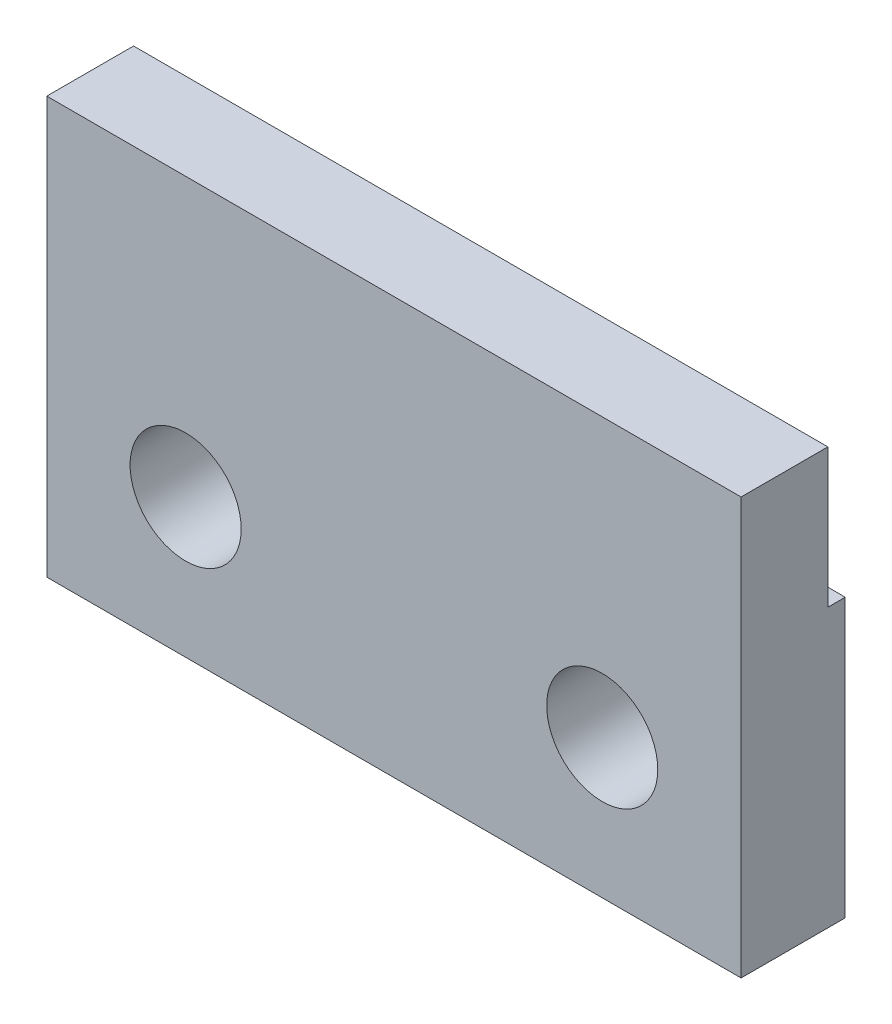
from build123d import *

# Parameters (mm, degrees)
SKETCH1_W            = 20
SKETCH1_H            = 12
BOSS_EXTRUDE1_DEPTH  = 3
SKETCH2_W            = 20
SKETCH2_H            = 4
CUT_EXTRUDE1_DEPTH   = 0.5
M3_CLEARANCE_HOLE1_D = 3.2


with BuildPart() as part:
    # Sketch1 → Boss-Extrude1 (new body)
    with BuildSketch(Plane.XY):
        Rectangle(SKETCH1_W, SKETCH1_H)
    extrude(amount=BOSS_EXTRUDE1_DEPTH)

    # Sketch2 → Cut-Extrude1 (cut)
    with BuildSketch(Plane(origin=(0, 0, 0), x_dir=(-1, 0, 0), z_dir=(0, 0, -1))):
        with Locations((0, 4)):
            Rectangle(SKETCH2_W, SKETCH2_H)
    extrude(amount=-CUT_EXTRUDE1_DEPTH, mode=Mode.SUBTRACT)

    # M3 Clearance Hole1 (through all)
    with Locations(Plane.XY.offset(3)):
        with Locations((-6, -2), (6, -2)):
            Hole(M3_CLEARANCE_HOLE1_D / 2)


solid = part.part
